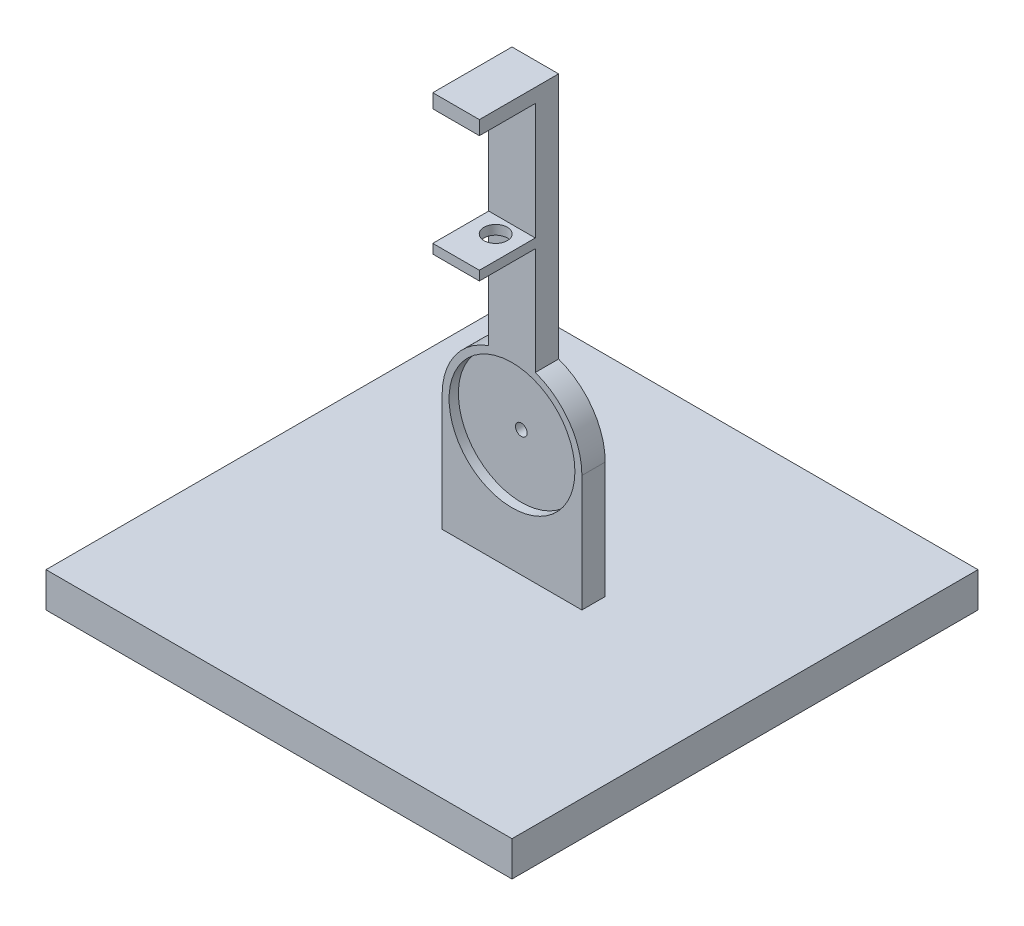
from build123d import *

# Parameters (mm, degrees)
SKETCH1_W           = 100
SKETCH1_H           = 7.5
BOSS_EXTRUDE1_DEPTH = 100
BOSS_EXTRUDE2_START = 45
BOSS_EXTRUDE2_DEPTH = 5
SKETCH3_R           = 13.5
CUT_EXTRUDE1_DEPTH  = 2
SKETCH4_W           = 10
SKETCH4_H           = 3
BOSS_EXTRUDE3_DEPTH = 17
SKETCH6_W           = 10
SKETCH6_H           = 12
SKETCH6_R           = 2.5
BOSS_EXTRUDE4_DEPTH = 2
CUT_EXTRUDE2_REACH  = 152.441
SKETCH7_R           = 1.25


with BuildPart() as part:
    # Sketch1 → Boss-Extrude1 (new body)
    with BuildSketch(Plane.XY):
        with Locations((50, 3.75)):
            Rectangle(SKETCH1_W, SKETCH1_H)
    extrude(amount=BOSS_EXTRUDE1_DEPTH)

    # Sketch2 → Boss-Extrude2 (add)
    with BuildSketch(Plane.XY.offset(BOSS_EXTRUDE2_START)):
        with BuildLine():
            Line((35, 7.5), (65, 7.5))
            Line((65, 7.5), (65, 32.5))
            ThreePointArc((65, 32.5), (62.247448714, 41.160254038), (55, 46.642135624))
            Line((55, 46.642135624), (55, 96.642135624))
            Line((55, 96.642135624), (45, 96.642135624))
            Line((45, 96.642135624), (45, 46.642135624))
            ThreePointArc((45, 46.642135624), (37.752551286, 41.160254038), (35, 32.5))
            Line((35, 32.5), (35, 7.5))
        make_face()
    extrude(amount=BOSS_EXTRUDE2_DEPTH)

    # Sketch3 → Cut-Extrude1 (cut)
    with BuildSketch(Plane.XY.offset(50)):
        with Locations((50, 32.5)):
            Circle(SKETCH3_R)
    extrude(amount=-CUT_EXTRUDE1_DEPTH, mode=Mode.SUBTRACT)

    # Sketch4 → Boss-Extrude3 (add)
    with BuildSketch(Plane(origin=(0, 0, 45), x_dir=(-1, 0, 0), z_dir=(0, 0, -1))):
        with Locations((-50, 98.142135624)):
            Rectangle(SKETCH4_W, SKETCH4_H)
    extrude(amount=-BOSS_EXTRUDE3_DEPTH)

    # Sketch6 → Boss-Extrude4 (add)
    with BuildSketch(Plane(origin=(0, 71.642135624, 0), x_dir=(-1, 0, 0), z_dir=(0, -1, 0))):
        with Locations((-50, -56)):
            Rectangle(SKETCH6_W, SKETCH6_H)
        with Locations(Location((-50, -53.5, 0), (0, 0, 90))):
            Circle(SKETCH6_R, mode=Mode.SUBTRACT)
    extrude(amount=BOSS_EXTRUDE4_DEPTH)

    # Sketch7 → Cut-Extrude2 (cut, up to next)
    with BuildSketch(Plane.XY.offset(48), mode=Mode.PRIVATE) as cut_extrude2_sk1:
        with Locations((50, 32.5)):
            Circle(SKETCH7_R)
    cut_extrude2_tool1 = extrude(cut_extrude2_sk1.sketch, amount=-CUT_EXTRUDE2_REACH, mode=Mode.PRIVATE) & part.part
    add(cut_extrude2_tool1.solids().sort_by_distance((50, 32.5, 48))[0], mode=Mode.SUBTRACT)


solid = part.part
